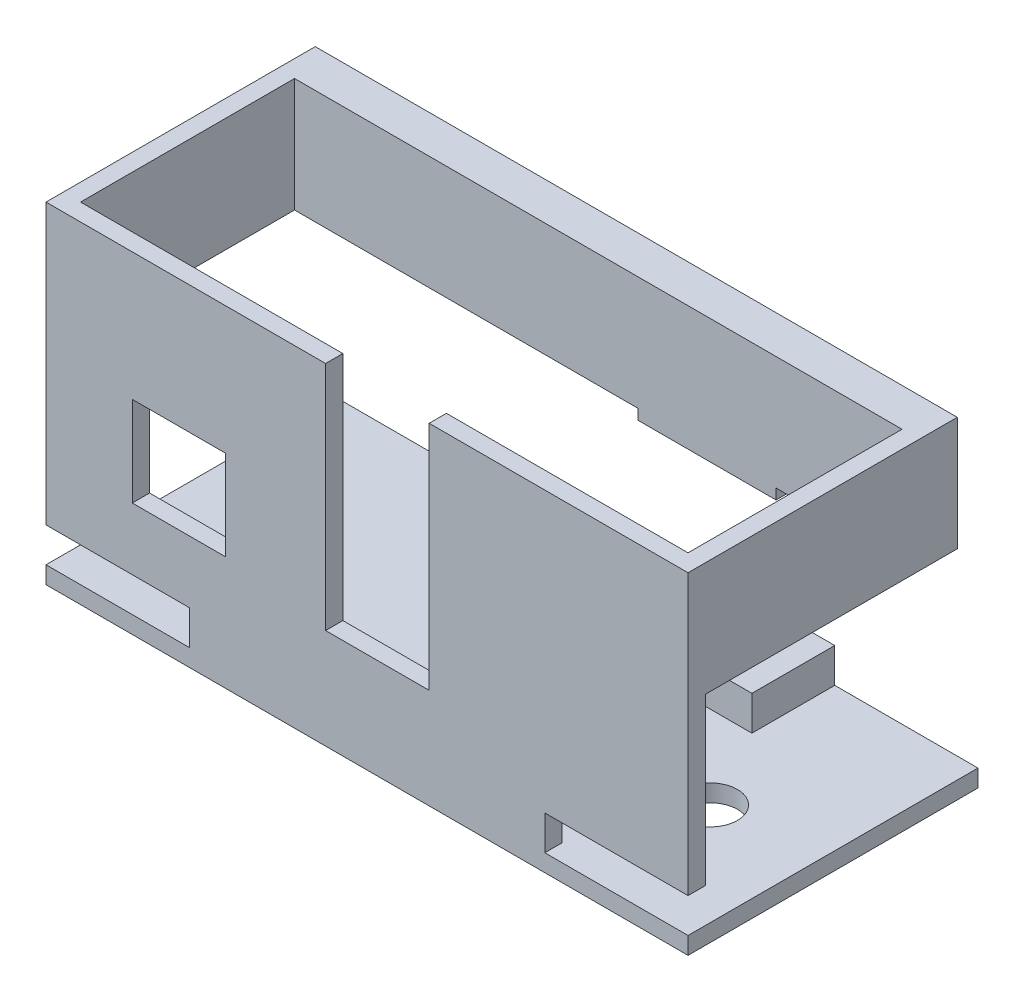
from build123d import *

# Parameters (mm, degrees)
SKETCH1_W               = 46.5
SKETCH1_H               = 24
BOSS_EXTRUDE1_DEPTH     = 21
SHELL1_T                = -1.25
SKETCH2_W               = 19.75
SKETCH2_H               = 14.5
CUT_EXTRUDE1_DEPTH      = 57.384838388
SKETCH4_W               = 6.75
SKETCH4_H               = 6.5
SKETCH4_W_2             = 7.5
SKETCH4_H_2             = 17
CUT_EXTRUDE3_DEPTH      = 1.25
CUT_EXTRUDE4_REACH      = 57.358
SKETCH6_R               = 1.95
SKETCH7_W               = 10.375
SKETCH7_H               = 2.5
CUT_EXTRUDE5_DEPTH      = 1.25
SKETCH9_W               = 19.5
SKETCH9_H               = 6
BOSS_EXTRUDE3_DEPTH     = 2.5
CUT_EXTRUDE7_DEPTH      = 102.634838388
CUT_EXTRUDE7_DEPTH_BACK = 57.384838388
CUT_EXTRUDE7_START      = -45.25
SKETCH12_W              = 1.5
SKETCH12_H              = 8.25
SKETCH13_W              = 2.75
SKETCH13_H              = 8.25
BOSS_EXTRUDE4_DEPTH     = 44
SKETCH15_W              = 10
SKETCH15_H              = 2.75
BOSS_EXTRUDE5_DEPTH     = 0.75


with BuildPart() as part:
    # Sketch1 → Boss-Extrude1 (new body)
    with BuildSketch(Plane.XY):
        with Locations((22, 12)):
            Rectangle(SKETCH1_W, SKETCH1_H)
    extrude(amount=-BOSS_EXTRUDE1_DEPTH)

    # Shell1
    shell1_openings = [part.faces().sort_by_distance(p)[0] for p in [
        (22, 12, -21),
        (22, 24, -10.5),
    ]]
    offset(amount=SHELL1_T, openings=shell1_openings, kind=Kind.INTERSECTION)

    # Sketch2 → Cut-Extrude1 (cut, through all)
    with BuildSketch(Plane.ZY.offset(1.25)):
        with Locations((-11.125, 8.5)):
            Rectangle(SKETCH2_W, SKETCH2_H)
    extrude(amount=-CUT_EXTRUDE1_DEPTH, mode=Mode.SUBTRACT)

    # Sketch4 → Cut-Extrude3 (cut)
    with BuildSketch(Plane.XY):
        with Locations((8.375, 11.5)):
            Rectangle(SKETCH4_W, SKETCH4_H)
        with Locations((22.75, 15.75)):
            Rectangle(SKETCH4_W_2, SKETCH4_H_2)
    extrude(amount=-CUT_EXTRUDE3_DEPTH, mode=Mode.SUBTRACT)

    # Sketch6 → Cut-Extrude4 (cut, up to next)
    with BuildSketch(Plane(origin=(0, 0, 0), x_dir=(-1, 0, 0), z_dir=(0, -1, 0)), mode=Mode.PRIVATE) as cut_extrude4_sk1:
        with Locations(Location((-6.125, 9, 0), (0, 0, 90))):
            Circle(SKETCH6_R)
    cut_extrude4_tool1 = extrude(cut_extrude4_sk1.sketch, amount=-CUT_EXTRUDE4_REACH, mode=Mode.PRIVATE) & part.part
    # Sketch6 → Cut-Extrude4 (cut, up to next)
    with BuildSketch(Plane(origin=(0, 0, 0), x_dir=(-1, 0, 0), z_dir=(0, -1, 0)), mode=Mode.PRIVATE) as cut_extrude4_sk2:
        with Locations(Location((-37.875, 9, 0), (0, 0, 90))):
            Circle(SKETCH6_R)
    cut_extrude4_tool2 = extrude(cut_extrude4_sk2.sketch, amount=-CUT_EXTRUDE4_REACH, mode=Mode.PRIVATE) & part.part
    add(cut_extrude4_tool1.solids().sort_by_distance((6.125, 0, -9))[0], mode=Mode.SUBTRACT)
    add(cut_extrude4_tool2.solids().sort_by_distance((37.875, 0, -9))[0], mode=Mode.SUBTRACT)

    # Sketch7 → Cut-Extrude5 (cut)
    with BuildSketch(Plane.XY):
        with Locations((40.0625, 2.5)):
            Rectangle(SKETCH7_W, SKETCH7_H)
        with Locations((3.9375, 2.5)):
            Rectangle(SKETCH7_W, SKETCH7_H)
    extrude(amount=-CUT_EXTRUDE5_DEPTH, mode=Mode.SUBTRACT)

    # Sketch9 → Boss-Extrude3 (add)
    with BuildSketch(Plane(origin=(0, 1.25, 0), x_dir=(1, 0, 0), z_dir=(0, 1, 0))):
        with Locations((25.125, 18)):
            Rectangle(SKETCH9_W, SKETCH9_H)
    extrude(amount=BOSS_EXTRUDE3_DEPTH)

    # Sketch12 → Cut-Extrude7 (cut, two sides: drawn at the far end of the back side and taken through both)
    with BuildSketch(Plane(origin=(45.25, 0, 0), x_dir=(0, 0, -1), z_dir=(1, 0, 0)).offset(CUT_EXTRUDE7_START - CUT_EXTRUDE7_DEPTH_BACK)):
        with Locations((20.25, 19.875)):
            Rectangle(SKETCH12_W, SKETCH12_H)
    extrude(amount=CUT_EXTRUDE7_DEPTH + CUT_EXTRUDE7_DEPTH_BACK, mode=Mode.SUBTRACT)

    # Sketch13 → Boss-Extrude4 (add)
    with BuildSketch(Plane(origin=(0, 0, 0), x_dir=(0, 0, -1), z_dir=(1, 0, 0))):
        with Locations((18.125, 19.875)):
            Rectangle(SKETCH13_W, SKETCH13_H)
    extrude(amount=BOSS_EXTRUDE4_DEPTH)

    # Sketch15 → Boss-Extrude5 (add)
    with BuildSketch(Plane.XZ.offset(-15.75)):
        with Locations((29.875, -18.125)):
            Rectangle(SKETCH15_W, SKETCH15_H)
    extrude(amount=BOSS_EXTRUDE5_DEPTH)


solid = part.part
